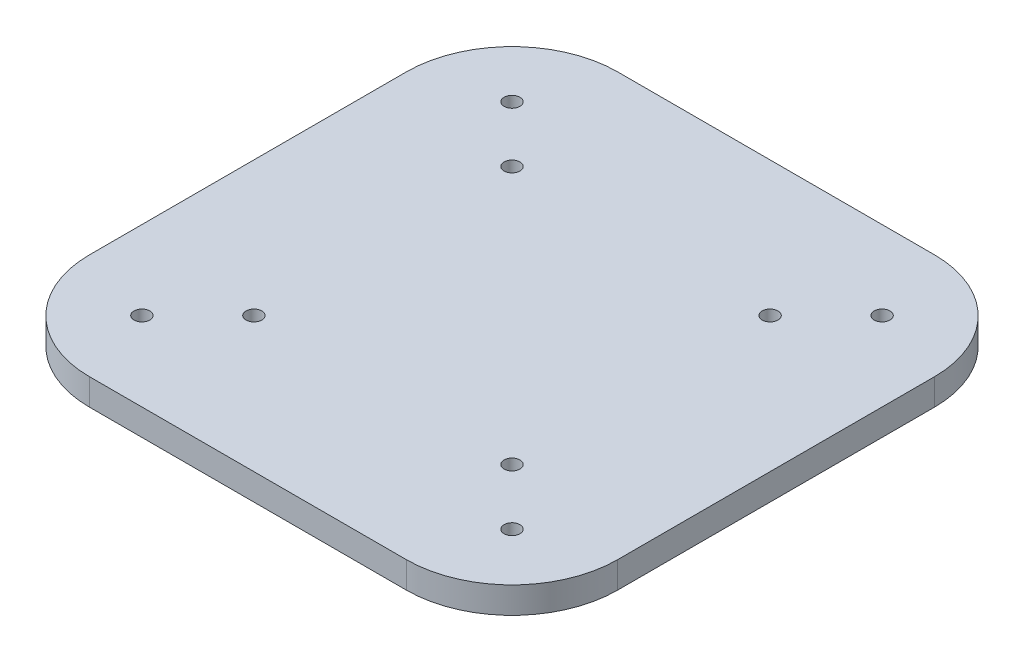
from build123d import *

# Parameters (mm, degrees)
BOSS_EXTRUDE1_DEPTH      = 5
F_3_0_3_DIAMETER_HOLE1_D = 3
LPATTERN1_15MM_COUNT     = 2
LPATTERN1_15MM_PITCH     = 15
CIRPATTERN2_COPY_1_D     = 3
CIRPATTERN2_COPY_2_D     = 3
CIRPATTERN2_COPY_3_D     = 3
CIRPATTERN2_COPY_4_D     = 3
CIRPATTERN2_COPY_5_D     = 3
CIRPATTERN2_COPY_6_D     = 3


with BuildPart() as part:
    # Sketch1 → Boss-Extrude1 (new body)
    with BuildSketch(Plane(origin=(0, 0, 0), x_dir=(1, 0, 0), z_dir=(0, 1, 0))):
        with BuildLine():
            Line((-42.436548223, 48.984771574), (17.563451777, 48.984771574))
            ThreePointArc((17.563451777, 48.984771574), (31.7055874, 43.126907197), (37.563451777, 28.984771574))
            Line((37.563451777, 28.984771574), (37.563451777, -31.015228426))
            ThreePointArc((37.563451777, -31.015228426), (31.7055874, -45.15736405), (17.563451777, -51.015228426))
            Line((17.563451777, -51.015228426), (-42.436548223, -51.015228426))
            ThreePointArc((-42.436548223, -51.015228426), (-56.578683847, -45.15736405), (-62.436548223, -31.015228426))
            Line((-62.436548223, -31.015228426), (-62.436548223, 28.984771574))
            ThreePointArc((-62.436548223, 28.984771574), (-56.578683847, 43.126907197), (-42.436548223, 48.984771574))
        make_face()
    extrude(amount=BOSS_EXTRUDE1_DEPTH)

    # Ø3.0 (3) Diameter Hole1 (through all)
    with Locations(Plane(origin=(0, 5, 0), x_dir=(1, 0, 0), z_dir=(0, 1, 0))):
        with Locations((22.563451777, -36.015228426)):
            f_3_0_3_diameter_hole1 = Hole(F_3_0_3_DIAMETER_HOLE1_D / 2)

    # LPattern1 15mm: Ø3.0 (3) Diameter Hole1 ×2
    with Locations(*[Vector(-0.707106781186548, 0, -0.7071067811865471) * (i * LPATTERN1_15MM_PITCH) for i in range(1, LPATTERN1_15MM_COUNT)]):
        add(f_3_0_3_diameter_hole1, mode=Mode.SUBTRACT)

    # CirPattern2 copy 1 (through all)
    with Locations(Plane(origin=(-0.901796575, 5, 2.845174932), x_dir=(0, 0, 1), z_dir=(0, 1, 0))):
        with Locations((22.563451777, -36.015228426)):
            Hole(CIRPATTERN2_COPY_1_D / 2)

    # CirPattern2 copy 2 (through all)
    with Locations(Plane(origin=(-14.353573225, 5, 12.549980075), x_dir=(-1, 0, 0), z_dir=(0, 1, 0))):
        with Locations((22.563451777, -36.015228426)):
            Hole(CIRPATTERN2_COPY_2_D / 2)

    # CirPattern2 copy 3 (through all)
    with Locations(Plane(origin=(-24.058378368, 5, -0.901796575), x_dir=(0, 0, -1), z_dir=(0, 1, 0))):
        with Locations((22.563451777, -36.015228426)):
            Hole(CIRPATTERN2_COPY_3_D / 2)

    # CirPattern2 copy 4 (through all)
    with Locations(Plane(origin=(-11.508398293, 5, 13.45177665), x_dir=(0, 0, 1), z_dir=(0, 1, 0))):
        with Locations((22.563451777, -36.015228426)):
            Hole(CIRPATTERN2_COPY_4_D / 2)

    # CirPattern2 copy 5 (through all)
    with Locations(Plane(origin=(-24.960174943, 5, 1.943378357), x_dir=(-1, 0, 0), z_dir=(0, 1, 0))):
        with Locations((22.563451777, -36.015228426)):
            Hole(CIRPATTERN2_COPY_5_D / 2)

    # CirPattern2 copy 6 (through all)
    with Locations(Plane(origin=(-13.45177665, 5, -11.508398293), x_dir=(0, 0, -1), z_dir=(0, 1, 0))):
        with Locations((22.563451777, -36.015228426)):
            Hole(CIRPATTERN2_COPY_6_D / 2)


solid = part.part
